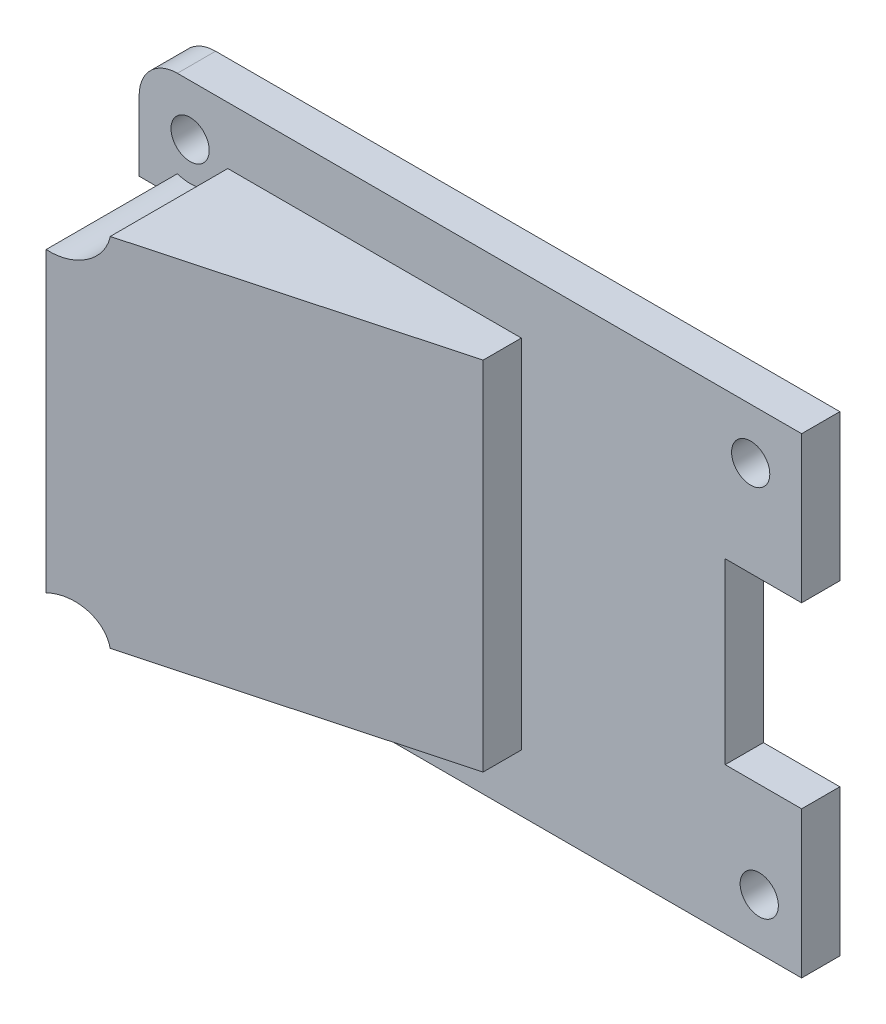
from build123d import *

# Parameters (mm, degrees)
CROQUIS1_W              = 52
CROQUIS1_H              = 37
SALIENTE_EXTRUIR1_DEPTH = 3
REDONDEO1_R             = 3
CROQUIS2_R              = 1.5
CORTAR_EXTRUIR1_DEPTH   = 3
CROQUIS3_W              = 29
CROQUIS3_H              = 20
CROQUIS3_W_2            = 6
CROQUIS3_H_2            = 14
CORTAR_EXTRUIR2_DEPTH   = 3
SALIENTE_EXTRUIR2_DEPTH = 9
CROQUIS5_W              = 36
CROQUIS5_H              = 28.002550662
SALIENTE_EXTRUIR3_DEPTH = 10.3
CORTAR_EXTRUIR3_START   = -28.002551
CORTAR_EXTRUIR3_DEPTH   = 28.002551
SALIENTE_EXTRUIR4_DEPTH = 8.5
CROQUIS8_W              = 21.9
CROQUIS8_H              = 60.9
CORTAR_EXTRUIR4_DEPTH   = 5.5
CORTAR_EXTRUIR5_DEPTH   = 9
CORTAR_EXTRUIR6_START   = -28.002551
CROQUIS12_W             = 9
CROQUIS12_H             = 1.570892211
CORTAR_EXTRUIR6_DEPTH   = 28.002551
CROQUIS13_W             = 3
CROQUIS13_H             = 67
SALIENTE_EXTRUIR5_DEPTH = 12
CORTAR_EXTRUIR7_START   = -28.002551
CROQUIS14_W             = 31
CROQUIS14_H             = 9
CORTAR_EXTRUIR7_DEPTH   = 28.002551
CROQUIS17_R             = 1.5
SALIENTE_EXTRUIR6_DEPTH = 9
CORTAR_EXTRUIR8_START   = -37
CROQUIS18_W             = 54.197150846
CROQUIS18_H             = 9
CORTAR_EXTRUIR8_DEPTH   = 37
CORTAR_EXTRUIR9_REACH   = 83.194
CROQUIS19_R             = 1.5
CROQUIS20_W             = 28
CROQUIS20_H             = 6
SALIENTE_EXTRUIR7_DEPTH = 3
CROQUIS21_W             = 20
CROQUIS21_H             = 4.5
CORTAR_EXTRUIR10_DEPTH  = 2
CROQUIS22_R             = 3
CORTAR_EXTRUIR11_DEPTH  = 10.3
CORTAR_EXTRUIR12_REACH  = 82.263
CROQUIS23_R             = 2
CORTAR_EXTRUIR13_START  = -20.5
CROQUIS24_W             = 31.641373031
CROQUIS24_H             = 75.620640488
CORTAR_EXTRUIR13_DEPTH  = 20.5
CROQUIS25_W             = 28
CROQUIS25_H             = 6
CORTAR_EXTRUIR14_DEPTH  = 10
SALIENTE_EXTRUIR8_DEPTH = 9
CORTAR_EXTRUIR16_REACH  = 72.776
CROQUIS30_R             = 3


with BuildPart() as part:
    # Croquis1 → Saliente-Extruir1 (new body)
    with BuildSketch(Plane.XY):
        with Locations((-39.296803653, 6.787671233)):
            Rectangle(CROQUIS1_W, CROQUIS1_H)
    extrude(amount=SALIENTE_EXTRUIR1_DEPTH)

    # Redondeo1
    redondeo1_edges = [part.edges().sort_by_distance(p)[0] for p in [
        (-65.296803653, 25.287671233, 1.5),
        (-65.296803653, -11.712328767, 1.5),
    ]]
    fillet(redondeo1_edges, radius=REDONDEO1_R)

    # Croquis2 → Cortar-Extruir1 (cut)
    with BuildSketch(Plane.XY.offset(3)):
        with Locations((-61.296803653, 21.287671233)):
            Circle(CROQUIS2_R)
        with Locations((-61.296803653, -7.712328767)):
            Circle(CROQUIS2_R)
        with Locations((-16.624072342, -7.712328767)):
            Circle(CROQUIS2_R)
        with Locations((-17.296803653, 21.287671233)):
            Circle(CROQUIS2_R)
    extrude(amount=-CORTAR_EXTRUIR1_DEPTH, mode=Mode.SUBTRACT)

    # Croquis3 → Cortar-Extruir2 (cut)
    with BuildSketch(Plane.XY.offset(3)):
        with Locations((-50.796803653, 6.787671233)):
            Rectangle(CROQUIS3_W, CROQUIS3_H)
        with Locations((-16.296803653, 6.787671233)):
            Rectangle(CROQUIS3_W_2, CROQUIS3_H_2)
    extrude(amount=-CORTAR_EXTRUIR2_DEPTH, mode=Mode.SUBTRACT)

    # Croquis4 → Saliente-Extruir2 (add)
    with BuildSketch(Plane.XY.offset(3)):
        Polygon((-57.296803653, 16.787671233), (-57.296803653, 20.790221895), (-26.296803653, 20.790221895), (-26.296803653, -7.212328767), (-57.296803653, -7.212328767), (-57.296803653, -3.212328767), (-36.296803653, -3.212328767), (-36.296803653, 16.787671233), align=None)
    extrude(amount=SALIENTE_EXTRUIR2_DEPTH)

    # Croquis5 → Saliente-Extruir3 (add)
    with BuildSketch(Plane.XY.offset(12)):
        with Locations((-44.296803653, 6.788946564)):
            Rectangle(CROQUIS5_W, CROQUIS5_H)
    extrude(amount=SALIENTE_EXTRUIR3_DEPTH)

    # Croquis6 → Cortar-Extruir3 (cut)
    with BuildSketch(Plane.XZ.offset(7.212328767).offset(CORTAR_EXTRUIR3_START)):
        Polygon((-35.296803653, 15), (-35.296803653, 12.995381041), (-26.296803653, 12.995381041), (-26.296803653, 14.757444162), (-26.296803653, 22.3), (-62.296803653, 22.3), align=None)
    extrude(amount=CORTAR_EXTRUIR3_DEPTH, mode=Mode.SUBTRACT)

    # Croquis7 → Saliente-Extruir4 (add)
    with BuildSketch(Plane(origin=(1.374852463, 0, 5.085070754), x_dir=(0.9653390502996949, 0, -0.2609990765625102), z_dir=(0.2609990765625102, 0, 0.9653390502996949))):
        Polygon((-65.957816682, 6.788946564), (-65.957816682, -26.711053436), (-37.957816682, -26.711053436), (-37.957816682, 40.288946564), (-65.957816682, 40.288946564), align=None)
    extrude(amount=SALIENTE_EXTRUIR4_DEPTH)

    # Croquis8 → Cortar-Extruir4 (cut)
    with BuildSketch(Plane(origin=(3.593344614, 0, 13.290452681), x_dir=(0.9653390502996949, 0, -0.26099907656251026), z_dir=(0.26099907656251026, 0, 0.9653390502996949))):
        with Locations((-51.957816682, 6.788946564)):
            Rectangle(CROQUIS8_W, CROQUIS8_H)
    extrude(amount=-CORTAR_EXTRUIR4_DEPTH, mode=Mode.SUBTRACT)

    # Croquis10 → Cortar-Extruir5 (cut)
    with BuildSketch(Plane(origin=(0, 20.790221895, 0), x_dir=(1, 0, 0), z_dir=(0, 1, 0))):
        Polygon((-62.296803653, -22.3), (-35.296803653, -15), (-35.296803653, -12), (-62.296803653, -19.3), align=None)
    extrude(amount=-CORTAR_EXTRUIR5_DEPTH, mode=Mode.SUBTRACT)

    # Croquis12 → Cortar-Extruir6 (cut)
    with BuildSketch(Plane(origin=(0, 20.790221895, 0), x_dir=(1, 0, 0), z_dir=(0, 1, 0)).offset(CORTAR_EXTRUIR6_START)):
        with Locations((-30.796803653, -12.209934936)):
            Rectangle(CROQUIS12_W, CROQUIS12_H)
    extrude(amount=CORTAR_EXTRUIR6_DEPTH, mode=Mode.SUBTRACT)

    # Croquis13 → Saliente-Extruir5 (add)
    with BuildSketch(Plane(origin=(3.593344614, 0, 13.290452681), x_dir=(0.9653390502996949, 0, -0.26099907656251026), z_dir=(0.26099907656251026, 0, 0.9653390502996949))):
        with Locations((-39.457816682, 6.788946564)):
            Rectangle(CROQUIS13_W, CROQUIS13_H)
    extrude(amount=SALIENTE_EXTRUIR5_DEPTH)

    # Croquis14 → Cortar-Extruir7 (cut)
    with BuildSketch(Plane.XZ.offset(7.212328767).offset(CORTAR_EXTRUIR7_START)):
        with Locations((-41.796803653, 7.5)):
            Rectangle(CROQUIS14_W, CROQUIS14_H)
    extrude(amount=CORTAR_EXTRUIR7_DEPTH, mode=Mode.SUBTRACT)


with BuildPart() as cortar_extruir7_piece_1:
    # of the separate pieces the step leaves, piece 1, a body of its own (cortar_extruir7_pieces)
    add(part.part.solids().sort_by_distance((-62.296803653, -26.711053436, 22.3))[0])



with BuildPart() as cortar_extruir7_piece_2:
    # of the separate pieces the step leaves, piece 2, a body of its own (cortar_extruir7_pieces)
    add(part.part.solids().sort_by_distance((-62.296803653, 25.287671233, 3))[0])


with BuildPart() as cortar_extruir7_piece_1_1:
    add(cortar_extruir7_piece_1.part)

    add(cortar_extruir7_piece_2.part)  # Saliente-Extruir6 merges Cortar-Extruir7 piece 2
    # Croquis17 → Saliente-Extruir6 (add)
    with BuildSketch(Plane.XY.offset(3)):
        with BuildLine():
            Line((-13.296803653, -0.212328767), (-19.296803653, -0.212328767))
            Line((-19.296803653, -0.212328767), (-19.296803653, 13.787671233))
            Line((-19.296803653, 13.787671233), (-13.296803653, 13.787671233))
            Line((-13.296803653, 13.787671233), (-13.296803653, 25.287671233))
            Line((-13.296803653, 25.287671233), (-62.296803653, 25.287671233))
            ThreePointArc((-62.296803653, 25.287671233), (-64.418123997, 24.408991576), (-65.296803653, 22.287671233))
            Line((-65.296803653, 22.287671233), (-65.296803653, 16.787671233))
            Line((-65.296803653, 16.787671233), (-36.296803653, 16.787671233))
            Line((-36.296803653, 16.787671233), (-36.296803653, -3.212328767))
            Line((-36.296803653, -3.212328767), (-65.296803653, -3.212328767))
            Line((-65.296803653, -3.212328767), (-65.296803653, -8.712328767))
            ThreePointArc((-65.296803653, -8.712328767), (-64.418123997, -10.833649111), (-62.296803653, -11.712328767))
            Line((-62.296803653, -11.712328767), (-13.296803653, -11.712328767))
            Line((-13.296803653, -11.712328767), (-13.296803653, -0.212328767))
        make_face()
        with Locations((-61.296803653, 21.287671233)):
            Circle(CROQUIS17_R, mode=Mode.SUBTRACT)
        with Locations((-61.296803653, -7.712328767)):
            Circle(CROQUIS17_R, mode=Mode.SUBTRACT)
        with Locations((-16.624072342, -7.712328767)):
            Circle(CROQUIS17_R, mode=Mode.SUBTRACT)
        with Locations((-17.296803653, 21.287671233)):
            Circle(CROQUIS17_R, mode=Mode.SUBTRACT)
    extrude(amount=SALIENTE_EXTRUIR6_DEPTH)

    # Croquis18 → Cortar-Extruir8 (cut)
    with BuildSketch(Plane.XZ.offset(11.712328767).offset(CORTAR_EXTRUIR8_START)):
        with Locations((-40.395379076, 4.5)):
            Rectangle(CROQUIS18_W, CROQUIS18_H)
    extrude(amount=CORTAR_EXTRUIR8_DEPTH, mode=Mode.SUBTRACT)

    # Cortar-Extruir9: up to this plane
    cortar_extruir9_end = Plane(origin=(3.593344614, 0, 13.290452681), z_dir=(0.26099907656251026, 0, 0.9653390502996949))
    # Croquis19 → Cortar-Extruir9 (cut, up to the surface)
    with BuildSketch(Plane(origin=(0, 0, 9), x_dir=(-1, 0, 0), z_dir=(0, 0, -1)), mode=Mode.PRIVATE) as cortar_extruir9_sk1:
        with Locations(Location((61.296803653, 21.287671233, 0), (0, 0, 180))):
            Circle(CROQUIS19_R)
    cortar_extruir9_tool1 = split(extrude(cortar_extruir9_sk1.sketch, amount=-CORTAR_EXTRUIR9_REACH, mode=Mode.PRIVATE), bisect_by=cortar_extruir9_end, keep=Keep.BOTH, mode=Mode.PRIVATE)
    add(cortar_extruir9_tool1.solids().sort_by_distance((-61.296804, 21.287671, 9))[0], mode=Mode.SUBTRACT)
    # Croquis19 → Cortar-Extruir9 (cut, up to the surface)
    with BuildSketch(Plane(origin=(0, 0, 9), x_dir=(-1, 0, 0), z_dir=(0, 0, -1)), mode=Mode.PRIVATE) as cortar_extruir9_sk2:
        with Locations(Location((61.296803653, -7.712328767, 0), (0, 0, 180))):
            Circle(CROQUIS19_R)
    cortar_extruir9_tool2 = split(extrude(cortar_extruir9_sk2.sketch, amount=-CORTAR_EXTRUIR9_REACH, mode=Mode.PRIVATE), bisect_by=cortar_extruir9_end, keep=Keep.BOTH, mode=Mode.PRIVATE)
    add(cortar_extruir9_tool2.solids().sort_by_distance((-61.296804, -7.712329, 9))[0], mode=Mode.SUBTRACT)

    # Croquis20 → Saliente-Extruir7 (add)
    with BuildSketch(Plane(origin=(1.374852463, 0, 5.085070754), x_dir=(-0.9653390502996949, 0, 0.26099907656251026), z_dir=(-0.26099907656251026, 0, -0.9653390502996949))):
        with Locations((51.957816682, 37.288946564)):
            Rectangle(CROQUIS20_W, CROQUIS20_H)
    extrude(amount=SALIENTE_EXTRUIR7_DEPTH)

    # Croquis21 → Cortar-Extruir10 (cut)
    with BuildSketch(Plane(origin=(0, 0, 9), x_dir=(-1, 0, 0), z_dir=(0, 0, -1))):
        with Locations((45.296803653, 19.037671233)):
            Rectangle(CROQUIS21_W, CROQUIS21_H)
        with Locations((45.296803653, -5.462328767)):
            Rectangle(CROQUIS21_W, CROQUIS21_H)
    extrude(amount=-CORTAR_EXTRUIR10_DEPTH, mode=Mode.SUBTRACT)

    # Croquis22 → Cortar-Extruir11 (cut)
    with BuildSketch(Plane.XY.offset(12)):
        with Locations((-61.296803653, 21.287671233)):
            Circle(CROQUIS22_R)
        with Locations((-61.296803653, -7.712328767)):
            Circle(CROQUIS22_R)
    extrude(amount=CORTAR_EXTRUIR11_DEPTH, mode=Mode.SUBTRACT)

    # Cortar-Extruir12: up to this plane
    cortar_extruir12_end = Plane(origin=(3.593344614, 0, 13.290452681), z_dir=(0.26099907656251026, 0, 0.9653390502996949))
    # Croquis23 → Cortar-Extruir12 (cut, up to the surface)
    with BuildSketch(Plane.XY.offset(12), mode=Mode.PRIVATE) as cortar_extruir12_sk1:
        with Locations((-61.296803653, 21.287671233)):
            Circle(CROQUIS23_R)
    cortar_extruir12_tool1 = split(extrude(cortar_extruir12_sk1.sketch, amount=CORTAR_EXTRUIR12_REACH, mode=Mode.PRIVATE), bisect_by=cortar_extruir12_end, keep=Keep.BOTH, mode=Mode.PRIVATE)
    add(cortar_extruir12_tool1.solids().sort_by_distance((-61.296804, 21.287671, 12))[0], mode=Mode.SUBTRACT)
    # Croquis23 → Cortar-Extruir12 (cut, up to the surface)
    with BuildSketch(Plane.XY.offset(12), mode=Mode.PRIVATE) as cortar_extruir12_sk2:
        with Locations((-61.296803653, -7.712328767)):
            Circle(CROQUIS23_R)
    cortar_extruir12_tool2 = split(extrude(cortar_extruir12_sk2.sketch, amount=CORTAR_EXTRUIR12_REACH, mode=Mode.PRIVATE), bisect_by=cortar_extruir12_end, keep=Keep.BOTH, mode=Mode.PRIVATE)
    add(cortar_extruir12_tool2.solids().sort_by_distance((-61.296804, -7.712329, 12))[0], mode=Mode.SUBTRACT)

    # Croquis24 → Cortar-Extruir13 (cut)
    with BuildSketch(Plane(origin=(1.374852463, 0, 5.085070754), x_dir=(-0.9653390502996949, 0, 0.26099907656251026), z_dir=(-0.26099907656251026, 0, -0.9653390502996949)).offset(CORTAR_EXTRUIR13_START)):
        with Locations((53.778503198, 11.099266808)):
            Rectangle(CROQUIS24_W, CROQUIS24_H)
    extrude(amount=CORTAR_EXTRUIR13_DEPTH, mode=Mode.SUBTRACT)


with BuildPart() as cortar_extruir13_piece_1:
    # of the separate pieces the step leaves, piece 1, a body of its own (cortar_extruir13_pieces)
    add(cortar_extruir7_piece_1_1.part.solids().sort_by_distance((-59.796803653, 21.287671233, 12))[0])

    # Croquis27 → Saliente-Extruir8 (add)
    with BuildSketch(Plane(origin=(0, 11.790221895, 0), x_dir=(1, 0, 0), z_dir=(0, 1, 0))):
        Polygon((-35.296803653, -12), (-35.296803653, -15), (-62.296803653, -22.3), (-62.296803653, -19.3), align=None)
    extrude(amount=SALIENTE_EXTRUIR8_DEPTH)

    # Cortar-Extruir16: up to this plane
    cortar_extruir16_end = Plane(origin=(1.374852463, 0, 5.085070754), z_dir=(0.2609990765625103, 0, 0.965339050299695))
    # Croquis30 → Cortar-Extruir16 (cut, up to the surface)
    with BuildSketch(Plane.XY.offset(12), mode=Mode.PRIVATE) as cortar_extruir16_sk1:
        with Locations((-61.296803653, 21.287671233)):
            Circle(CROQUIS30_R)
    cortar_extruir16_tool1 = split(extrude(cortar_extruir16_sk1.sketch, amount=CORTAR_EXTRUIR16_REACH, mode=Mode.PRIVATE), bisect_by=cortar_extruir16_end, keep=Keep.BOTH, mode=Mode.PRIVATE)
    add(cortar_extruir16_tool1.solids().sort_by_distance((-61.296804, 21.287671, 12))[0], mode=Mode.SUBTRACT)


with BuildPart() as cortar_extruir13_piece_2:
    # of the separate pieces the step leaves, piece 2, a body of its own (cortar_extruir13_pieces)
    add(cortar_extruir7_piece_1_1.part.solids().sort_by_distance((-35.267310245, 34.288946564, 14.992025856))[0])

    # Croquis25 → Cortar-Extruir14 (cut)
    with BuildSketch(Plane(origin=(0.591855233, 0, 2.189053603), x_dir=(-0.9653390502996949, 0, 0.26099907656251037), z_dir=(-0.26099907656251037, 0, -0.9653390502996949))):
        with Locations((51.957816682, 37.288946564)):
            Rectangle(CROQUIS25_W, CROQUIS25_H)
    extrude(amount=-CORTAR_EXTRUIR14_DEPTH, mode=Mode.SUBTRACT)


solid = cortar_extruir13_piece_1.part
